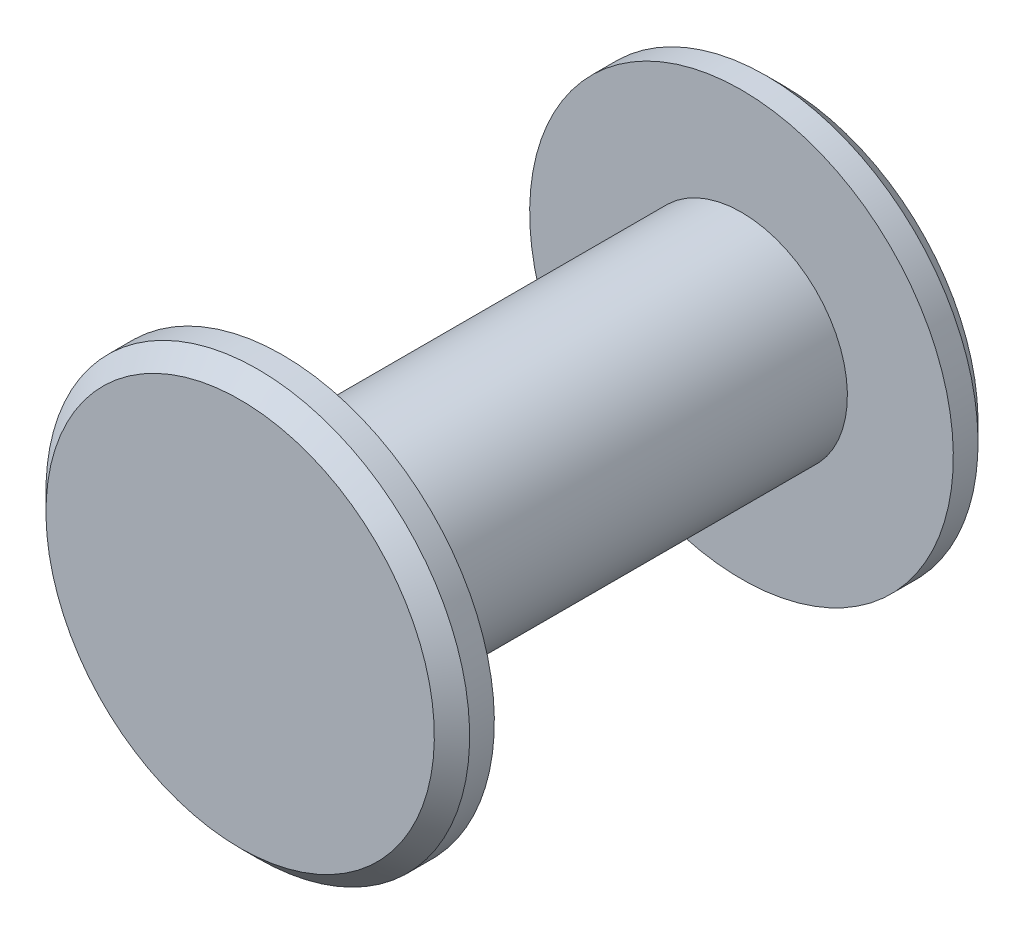
from build123d import *

# Parameters (mm, degrees)
CHAMFER1_SIZE = 0.25


with BuildPart() as part:
    # Sketch1 → Revolve1 (revolve)
    with BuildSketch(Plane(origin=(0, 0, 0), x_dir=(0, 0, -1), z_dir=(1, 0, 0))):
        Polygon((0, 0), (0, 3), (0.6, 3), (0.6, 1.5), (7.1, 1.5), (7.1, 3), (7.7, 3), (7.7, 0), align=None)
    revolve(axis=Axis((0, 0, 0), (0, 0, 1)))

    # Chamfer1
    chamfer1_edges = [part.edges().sort_by_distance(p)[0] for p in [
        (0, -3, -7.7),
        (0, -3, 0),
    ]]
    chamfer(chamfer1_edges, length=CHAMFER1_SIZE)


solid = part.part
